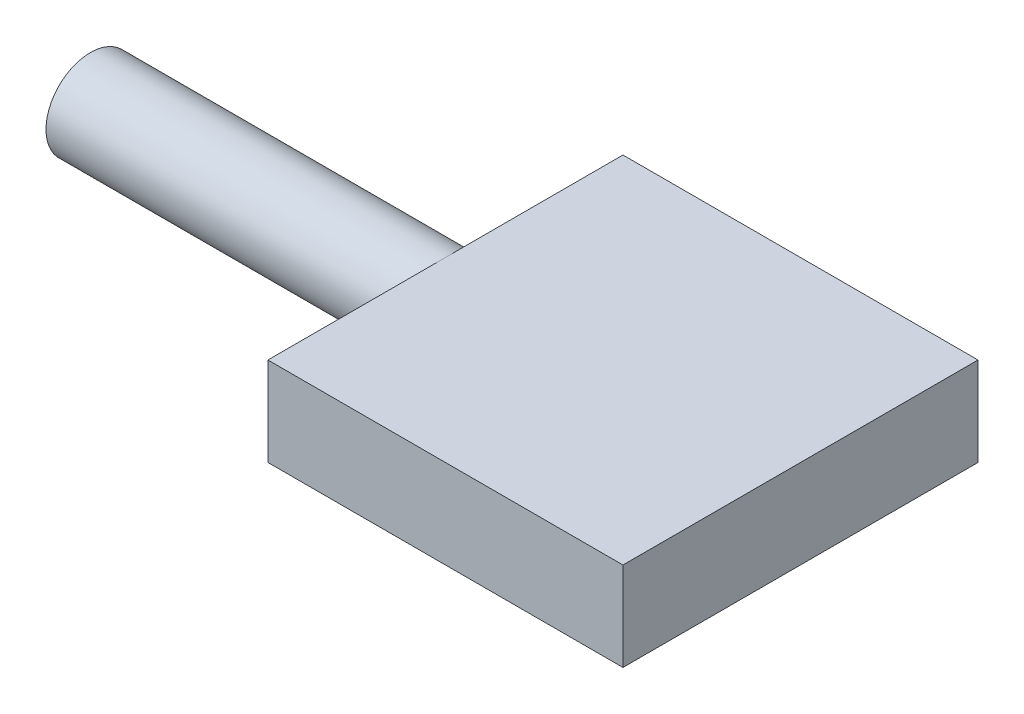
from build123d import *

# Parameters (mm, degrees)
CROQUIS1_W              = 40
CROQUIS1_H              = 40
SALIENTE_EXTRUIR1_DEPTH = 10
CROQUIS2_R              = 5
SALIENTE_EXTRUIR2_DEPTH = 40


with BuildPart() as part:
    # Croquis1 → Saliente-Extruir1 (new body)
    with BuildSketch(Plane(origin=(0, 0, 0), x_dir=(1, 0, 0), z_dir=(0, 1, 0))):
        with Locations((20, 20)):
            Rectangle(CROQUIS1_W, CROQUIS1_H)
    extrude(amount=SALIENTE_EXTRUIR1_DEPTH)

    # Croquis2 → Saliente-Extruir2 (add)
    with BuildSketch(Plane.ZY):
        with Locations(Location((-20, 5, 0), (0, 0, 270))):
            Circle(CROQUIS2_R)
    extrude(amount=SALIENTE_EXTRUIR2_DEPTH)


solid = part.part
